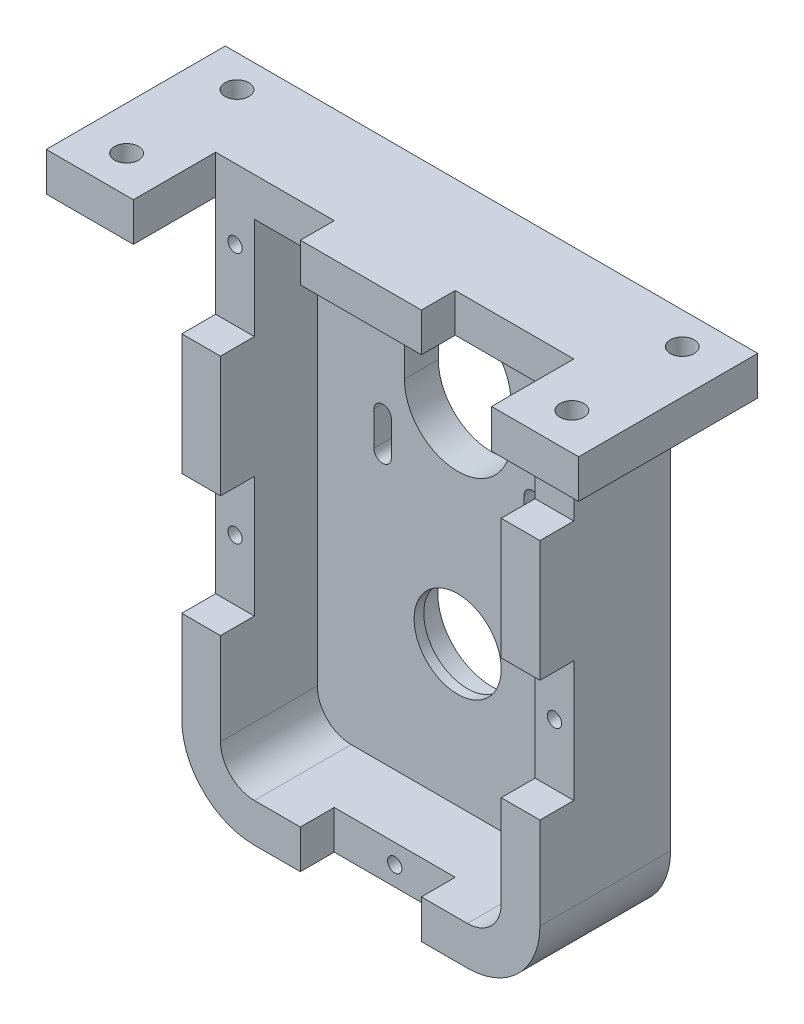
from build123d import *

# Parameters (mm, degrees)
CROQUIS2_R                = 9
SALIENTE_EXTRUIR1_DEPTH   = 7
CROQUIS2_5_W              = 18
CROQUIS2_5_H              = 8
SALIENTE_EXTRUIR2_DEPTH   = 37
SALIENTE_EXTRUIR2_2_DEPTH = 37
CROQUIS2_7_W              = 25
CROQUIS2_7_H              = 8
CROQUIS2_7_W_2            = 8
CROQUIS2_7_H_2            = 25
SALIENTE_EXTRUIR3_DEPTH   = 27
CROQUIS2_8_W              = 8
CROQUIS2_8_H              = 25
CROQUIS2_8_W_2            = 25
CROQUIS2_8_H_2            = 8
SALIENTE_EXTRUIR4_DEPTH   = 20
CROQUIS3_R                = 11.1
CORTAR_EXTRUIR1_DEPTH     = 5
CROQUIS9_R                = 2.475
CORTAR_EXTRUIR2_DEPTH     = 2.5
CROQUIS10_R               = 2.475
CORTAR_EXTRUIR3_DEPTH     = 8
CROQUIS11_R               = 1.475
CORTAR_EXTRUIR4_DEPTH     = 7


with BuildPart() as part:
    # Croquis2 → Saliente-Extruir1 (new body)
    with BuildSketch(Plane.XY):
        with BuildLine():
            Line((-5.786620614, 40.816010109), (-30.786620614, 40.816010109))
            Line((-30.786620614, 40.816010109), (-47.286620614, 40.816010109))
            Line((-47.286620614, 40.816010109), (-47.286620614, 19.816010109))
            Line((-47.286620614, 19.816010109), (-47.286620614, -5.183989891))
            Line((-47.286620614, -5.183989891), (-47.286620614, -30.183989891))
            Line((-47.286620614, -30.183989891), (-47.286620614, -49.183989891))
            ThreePointArc((-47.286620614, -49.183989891), (-45.236368082, -54.133737359), (-40.286620614, -56.183989891))
            Line((-40.286620614, -56.183989891), (-30.786620614, -56.183989891))
            Line((-30.786620614, -56.183989891), (-5.786620614, -56.183989891))
            Line((-5.786620614, -56.183989891), (3.713379386, -56.183989891))
            ThreePointArc((3.713379386, -56.183989891), (8.663126854, -54.133737359), (10.713379386, -49.183989891))
            Line((10.713379386, -49.183989891), (10.713379386, -30.183989891))
            Line((10.713379386, -30.183989891), (10.713379386, -5.183989891))
            Line((10.713379386, -5.183989891), (10.713379386, 19.816010109))
            Line((10.713379386, 19.816010109), (10.713379386, 40.816010109))
            Line((10.713379386, 40.816010109), (-5.786620614, 40.816010109))
        make_face()
        with Locations((-18.286620614, -27.183989891)):
            Circle(CROQUIS2_R, mode=Mode.SUBTRACT)
        with BuildLine():
            ThreePointArc((-35.586620614, 6.205288522), (-33.786620614, 8.005288522), (-31.986620614, 6.205288522))
            Line((-31.986620614, 6.205288522), (-31.986620614, -0.794711478))
            ThreePointArc((-31.986620614, -0.794711478), (-33.786620614, -2.594711478), (-35.586620614, -0.794711478))
            Line((-35.586620614, -0.794711478), (-35.586620614, 6.205288522))
        make_face(mode=Mode.SUBTRACT)
        with BuildLine():
            ThreePointArc((-29.286620614, 21.705288522), (-18.286620614, 32.705288522), (-7.286620614, 21.705288522))
            Line((-7.286620614, 21.705288522), (-7.286620614, 14.705288522))
            ThreePointArc((-7.286620614, 14.705288522), (-18.286620614, 3.705288522), (-29.286620614, 14.705288522))
            Line((-29.286620614, 14.705288522), (-29.286620614, 21.705288522))
        make_face(mode=Mode.SUBTRACT)
        with BuildLine():
            ThreePointArc((-31.986620614, 30.205288522), (-33.786620614, 28.405288522), (-35.586620614, 30.205288522))
            Line((-35.586620614, 30.205288522), (-35.586620614, 37.205288522))
            ThreePointArc((-35.586620614, 37.205288522), (-33.786620614, 39.005288522), (-31.986620614, 37.205288522))
            Line((-31.986620614, 37.205288522), (-31.986620614, 30.205288522))
        make_face(mode=Mode.SUBTRACT)
        with BuildLine():
            ThreePointArc((-4.586620614, 6.205288522), (-2.786620614, 8.005288522), (-0.986620614, 6.205288522))
            Line((-0.986620614, 6.205288522), (-0.986620614, -0.794711478))
            ThreePointArc((-0.986620614, -0.794711478), (-2.786620614, -2.594711478), (-4.586620614, -0.794711478))
            Line((-4.586620614, -0.794711478), (-4.586620614, 6.205288522))
        make_face(mode=Mode.SUBTRACT)
        with BuildLine():
            ThreePointArc((-0.986620614, 30.205288522), (-2.786620614, 28.405288522), (-4.586620614, 30.205288522))
            Line((-4.586620614, 30.205288522), (-4.586620614, 37.205288522))
            ThreePointArc((-4.586620614, 37.205288522), (-2.786620614, 39.005288522), (-0.986620614, 37.205288522))
            Line((-0.986620614, 37.205288522), (-0.986620614, 30.205288522))
        make_face(mode=Mode.SUBTRACT)
    extrude(amount=SALIENTE_EXTRUIR1_DEPTH)

    # Croquis2<7> → Saliente-Extruir3 (add)
    with BuildSketch(Plane.XY):
        with Locations((-18.286620614, 44.816010109)):
            Rectangle(CROQUIS2_7_W, CROQUIS2_7_H)
        with Locations((-51.286620614, 7.316010109)):
            Rectangle(CROQUIS2_7_W_2, CROQUIS2_7_H_2)
        with Locations((14.713379386, 7.316010109)):
            Rectangle(CROQUIS2_7_W_2, CROQUIS2_7_H_2)
        with BuildLine():
            Line((-47.286620614, -49.183989891), (-47.286620614, -30.183989891))
            Line((-47.286620614, -30.183989891), (-55.286620614, -30.183989891))
            Line((-55.286620614, -30.183989891), (-55.286620614, -49.183989891))
            ThreePointArc((-55.286620614, -49.183989891), (-50.893222332, -59.790591609), (-40.286620614, -64.183989891))
            Line((-40.286620614, -64.183989891), (-30.786620614, -64.183989891))
            Line((-30.786620614, -64.183989891), (-30.786620614, -56.183989891))
            Line((-30.786620614, -56.183989891), (-40.286620614, -56.183989891))
            ThreePointArc((-40.286620614, -56.183989891), (-45.236368082, -54.133737359), (-47.286620614, -49.183989891))
        make_face()
        with BuildLine():
            Line((18.713379386, -30.183989891), (10.713379386, -30.183989891))
            Line((10.713379386, -30.183989891), (10.713379386, -49.183989891))
            ThreePointArc((10.713379386, -49.183989891), (8.663126854, -54.133737359), (3.713379386, -56.183989891))
            Line((3.713379386, -56.183989891), (-5.786620614, -56.183989891))
            Line((-5.786620614, -56.183989891), (-5.786620614, -64.183989891))
            Line((-5.786620614, -64.183989891), (3.713379386, -64.183989891))
            ThreePointArc((3.713379386, -64.183989891), (14.319981104, -59.790591609), (18.713379386, -49.183989891))
            Line((18.713379386, -49.183989891), (18.713379386, -30.183989891))
        make_face()
    extrude(amount=SALIENTE_EXTRUIR3_DEPTH)



with BuildPart() as body_2:
    # Croquis2<5> → Saliente-Extruir2 (new body)
    with BuildSketch(Plane.XY):
        with Locations((-64.286620614, 44.816010109)):
            Rectangle(CROQUIS2_5_W, CROQUIS2_5_H)
    extrude(amount=SALIENTE_EXTRUIR2_DEPTH)


with BuildPart() as body_3:
    # Croquis2<5> → Saliente-Extruir2 2 (new body)
    with BuildSketch(Plane.XY):
        with Locations((27.713379386, 44.816010109)):
            Rectangle(CROQUIS2_5_W, CROQUIS2_5_H)
    extrude(amount=SALIENTE_EXTRUIR2_2_DEPTH)


with BuildPart() as part_1:
    add(part.part)

    add(body_2.part)  # Saliente-Extruir4 merges body 2

    add(body_3.part)  # Saliente-Extruir4 merges body 3
    # Croquis2<8> → Saliente-Extruir4 (add)
    with BuildSketch(Plane.XY):
        Polygon((-30.786620614, 40.816010109), (-30.786620614, 48.816010109), (-55.286620614, 48.816010109), (-55.286620614, 19.816010109), (-47.286620614, 19.816010109), (-47.286620614, 40.816010109), align=None)
        Polygon((18.713379386, 48.816010109), (-5.786620614, 48.816010109), (-5.786620614, 40.816010109), (10.713379386, 40.816010109), (10.713379386, 19.816010109), (18.713379386, 19.816010109), align=None)
        with Locations((-51.286620614, -17.683989891)):
            Rectangle(CROQUIS2_8_W, CROQUIS2_8_H)
        with Locations((14.713379386, -17.683989891)):
            Rectangle(CROQUIS2_8_W, CROQUIS2_8_H)
        with Locations((-18.286620614, -60.183989891)):
            Rectangle(CROQUIS2_8_W_2, CROQUIS2_8_H_2)
    extrude(amount=SALIENTE_EXTRUIR4_DEPTH)

    # Croquis3 → Cortar-Extruir1 (cut)
    with BuildSketch(Plane(origin=(0, 0, 0), x_dir=(-1, 0, 0), z_dir=(0, 0, -1))):
        with Locations((18.286620614, -27.183989891)):
            Circle(CROQUIS3_R)
    extrude(amount=-CORTAR_EXTRUIR1_DEPTH, mode=Mode.SUBTRACT)

    # Croquis9 → Cortar-Extruir2 (cut)
    # profile 1 of 4: a face of its own
    with BuildSketch(Plane.XZ.offset(-40.816010109)):
        Polygon((-69.826620614, 29.4), (-67.056620614, 24.602219263), (-61.516620614, 24.602219263), (-58.746620614, 29.4), (-61.516620614, 34.197780737), (-67.056620614, 34.197780737), align=None)
        with Locations((-64.286620614, 29.4)):
            Circle(CROQUIS9_R, mode=Mode.SUBTRACT)
    # profile 2 of 4: a face of its own
    with BuildSketch(Plane.XZ.offset(-40.816010109)):
        Polygon((33.253379386, 6.6), (30.483379386, 11.397780737), (24.943379386, 11.397780737), (22.173379386, 6.6), (24.943379386, 1.802219263), (30.483379386, 1.802219263), align=None)
        with Locations((27.713379386, 6.6)):
            Circle(CROQUIS9_R, mode=Mode.SUBTRACT)
    # profile 3 of 4: a face of its own
    with BuildSketch(Plane.XZ.offset(-40.816010109)):
        Polygon((30.483379386, 34.197780737), (33.253379386, 29.4), (30.483379386, 24.602219263), (24.943379386, 24.602219263), (22.173379386, 29.4), (24.943379386, 34.197780737), align=None)
        with Locations((27.713379386, 29.4)):
            Circle(CROQUIS9_R, mode=Mode.SUBTRACT)
    # profile 4 of 4: a face of its own
    with BuildSketch(Plane.XZ.offset(-40.816010109)):
        Polygon((-67.056620614, 1.802219263), (-69.826620614, 6.6), (-67.056620614, 11.397780737), (-61.516620614, 11.397780737), (-58.746620614, 6.6), (-61.516620614, 1.802219263), align=None)
        with Locations((-64.286620614, 6.6)):
            Circle(CROQUIS9_R, mode=Mode.SUBTRACT)
    extrude(amount=-CORTAR_EXTRUIR2_DEPTH, mode=Mode.SUBTRACT)

    # Croquis10 → Cortar-Extruir3 (cut)
    with BuildSketch(Plane.XZ.offset(-40.816010109)):
        with Locations((-64.286620614, 29.4)):
            Circle(CROQUIS10_R)
        with Locations((-64.286620614, 6.6)):
            Circle(CROQUIS10_R)
        with Locations((27.713379386, 29.4)):
            Circle(CROQUIS10_R)
        with Locations((27.713379386, 6.6)):
            Circle(CROQUIS10_R)
    extrude(amount=-CORTAR_EXTRUIR3_DEPTH, mode=Mode.SUBTRACT)

    # Croquis11 → Cortar-Extruir4 (cut)
    with BuildSketch(Plane.XY.offset(20)):
        with Locations((-51.286620614, 34.316010109)):
            Circle(CROQUIS11_R)
        with Locations((-51.286620614, -17.683989891)):
            Circle(CROQUIS11_R)
        with Locations((-18.286620614, -60.183989891)):
            Circle(CROQUIS11_R)
        with Locations((14.713379386, -17.683989891)):
            Circle(CROQUIS11_R)
        with Locations((14.713379386, 34.316010109)):
            Circle(CROQUIS11_R)
    extrude(amount=-CORTAR_EXTRUIR4_DEPTH, mode=Mode.SUBTRACT)


solid = part_1.part
